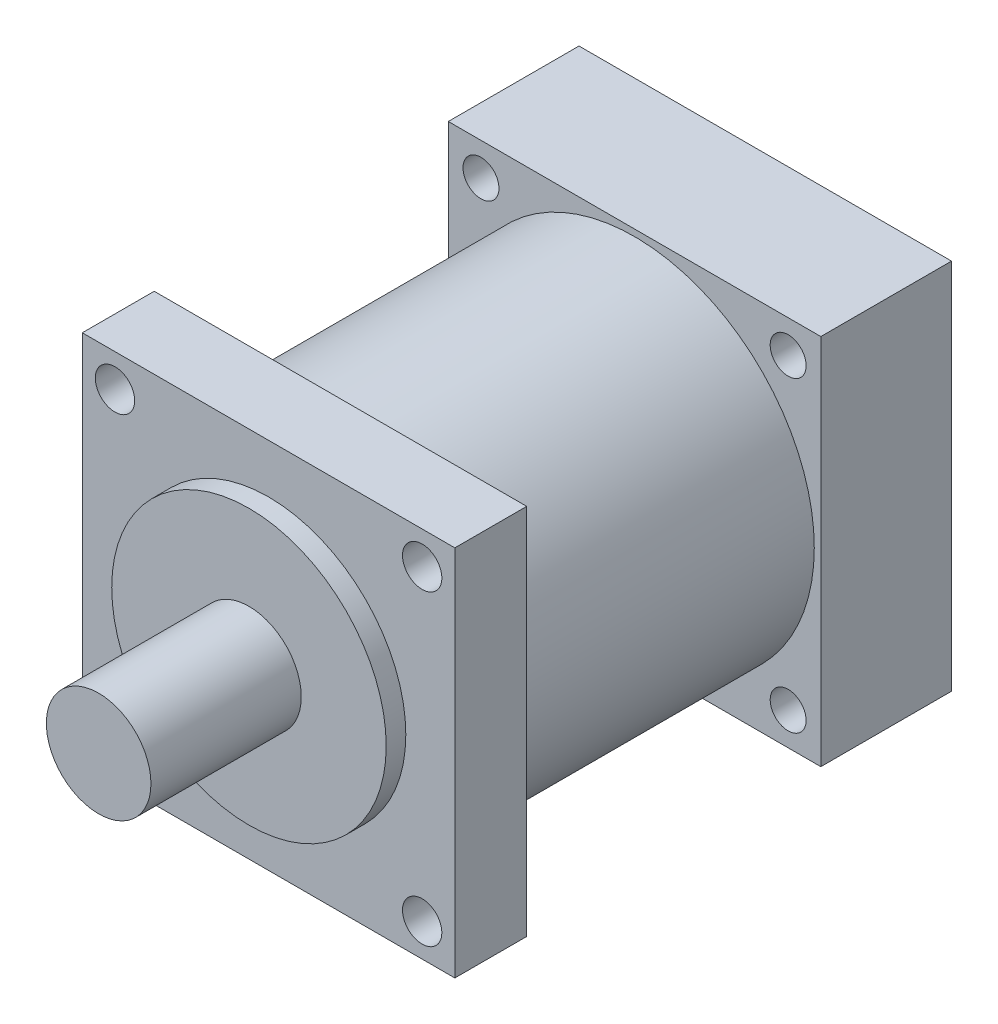
from build123d import *

# Parameters (mm, degrees)
SKETCH_1_W          = 57
SKETCH_1_H          = 57
SKETCH_1_R          = 3.010136902
EXTRUDE_1_DEPTH     = 11
SKETCH_2_R          = 21
EXTRUDE_2_DEPTH     = 3
SKETCH_3_R          = 8
EXTRUDE_3_DEPTH     = 23
SKETCH_4_R          = 27.5
EXTRUDE_4_DEPTH     = 45
SKETCH_5_W          = 57
SKETCH_5_H          = 57
EXTRUDE_5_DEPTH     = 20
SKETCH_6_R          = 2.75
CUT_EXTRUDE_1_DEPTH = 115.656991337
SKETCH_7_R          = 22.011376544
CUT_EXTRUDE_2_DEPTH = 30


with BuildPart() as part:
    # 草图1 → 凸台-拉伸1 (new body)
    with BuildSketch(Plane.XY):
        with Locations((4.996753247, 11.751623377)):
            Rectangle(SKETCH_1_W, SKETCH_1_H)
        with Locations((-18.503246753, 35.251623377)):
            Circle(SKETCH_1_R, mode=Mode.SUBTRACT)
        with Locations(Location((28.496753247, 35.251623377, 0), (0, 0, 180))):
            Circle(SKETCH_1_R, mode=Mode.SUBTRACT)
        with Locations(Location((-18.503246753, -11.748376623, 0), (0, 0, 180))):
            Circle(SKETCH_1_R, mode=Mode.SUBTRACT)
        with Locations((28.496753247, -11.748376623)):
            Circle(SKETCH_1_R, mode=Mode.SUBTRACT)
    extrude(amount=EXTRUDE_1_DEPTH)

    # 草图2 → 凸台-拉伸2 (add)
    with BuildSketch(Plane.XY.offset(11)):
        with Locations((4.996753247, 11.751623377)):
            Circle(SKETCH_2_R)
    extrude(amount=EXTRUDE_2_DEPTH)

    # 草图3 → 凸台-拉伸3 (add)
    with BuildSketch(Plane.XY.offset(14)):
        with Locations((4.996753247, 11.751623377)):
            Circle(SKETCH_3_R)
    extrude(amount=EXTRUDE_3_DEPTH)

    # 草图4 → 凸台-拉伸4 (add)
    with BuildSketch(Plane(origin=(0, 0, 0), x_dir=(-1, 0, 0), z_dir=(0, 0, -1))):
        with Locations(Location((-4.996753247, 11.751623377, 0), (0, 0, 180))):
            Circle(SKETCH_4_R)
    extrude(amount=EXTRUDE_4_DEPTH)

    # 草图5 → 凸台-拉伸5 (add)
    with BuildSketch(Plane(origin=(0, 0, -45), x_dir=(-1, 0, 0), z_dir=(0, 0, -1))):
        with Locations((-4.996753247, 11.751623377)):
            Rectangle(SKETCH_5_W, SKETCH_5_H)
    extrude(amount=EXTRUDE_5_DEPTH)

    # 草图6 → 切除-拉伸1 (cut, through all)
    with BuildSketch(Plane(origin=(0, 0, -65), x_dir=(-1, 0, 0), z_dir=(0, 0, -1))):
        with Locations((-28.496753247, 35.251623377)):
            Circle(SKETCH_6_R)
        with Locations(Location((18.503246753, 35.251623377, 0), (0, 0, 180))):
            Circle(SKETCH_6_R)
        with Locations(Location((18.503246753, -11.748376623, 0), (0, 0, 180))):
            Circle(SKETCH_6_R)
        with Locations((-28.496753247, -11.748376623)):
            Circle(SKETCH_6_R)
    extrude(amount=-CUT_EXTRUDE_1_DEPTH, mode=Mode.SUBTRACT)

    # 草图7 → 切除-拉伸2 (cut)
    with BuildSketch(Plane(origin=(0, 0, -65), x_dir=(-1, 0, 0), z_dir=(0, 0, -1))):
        with Locations((-4.996753247, 11.751623377)):
            Circle(SKETCH_7_R)
    extrude(amount=-CUT_EXTRUDE_2_DEPTH, mode=Mode.SUBTRACT)


solid = part.part
